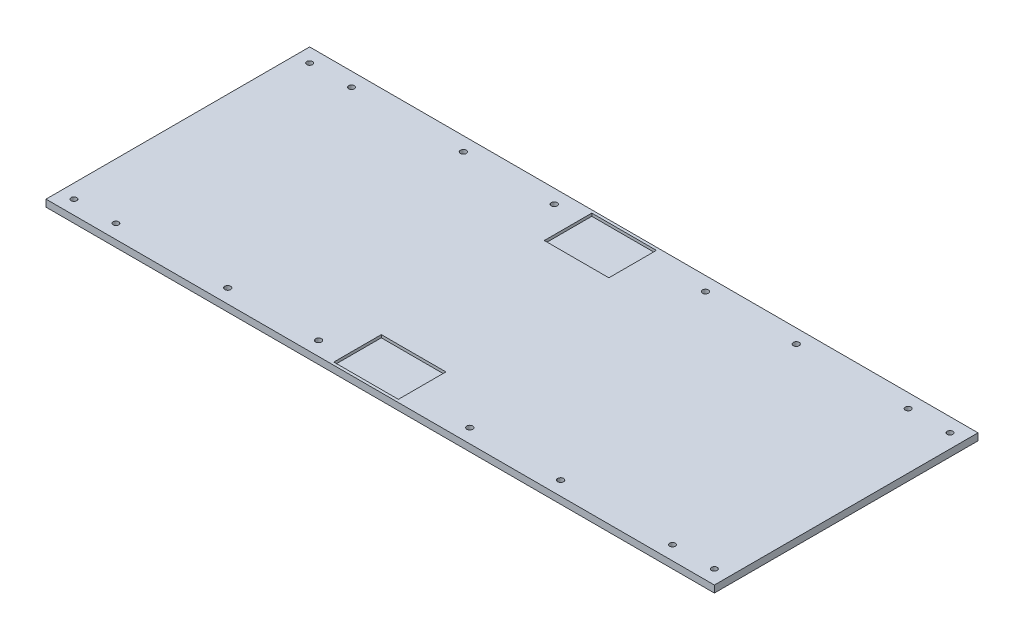
from build123d import *

# Parameters (mm, degrees)
ESQUISSE1_W             = 478.153686012
ESQUISSE1_H             = 188.593708553
ESQUISSE1_R             = 2
BOSS_EXTRU_4_DEPTH      = 5
ESQUISSE2_W             = 35.2
ESQUISSE2_H             = 34
ESQUISSE2_W_2           = 11
ENL_V_MAT_EXTRU_1_DEPTH = 2
ESQUISSE3_R             = 2.1
ENL_V_MAT_EXTRU_2_DEPTH = 10


with BuildPart() as part:
    # Esquisse1 → Boss.-Extru.4 (new body)
    with BuildSketch(Plane(origin=(0, 0, 0), x_dir=(1, 0, 0), z_dir=(0, 1, 0))):
        with Locations((166.159297522, 47.085285911)):
            Rectangle(ESQUISSE1_W, ESQUISSE1_H)
        with Locations(Location((-62.917545484, 131.382140187, 0), (0, 0, 270))):
            Circle(ESQUISSE1_R, mode=Mode.SUBTRACT)
        with Locations(Location((-62.917545484, -37.211568366, 0), (0, 0, 270))):
            Circle(ESQUISSE1_R, mode=Mode.SUBTRACT)
        with Locations(Location((395.236140528, -37.211568366, 0), (0, 0, 270))):
            Circle(ESQUISSE1_R, mode=Mode.SUBTRACT)
        with Locations(Location((395.236140528, 131.382140187, 0), (0, 0, 270))):
            Circle(ESQUISSE1_R, mode=Mode.SUBTRACT)
        with Locations(Location((-32.917545484, -37.211568366, 0), (0, 0, 270))):
            Circle(ESQUISSE1_R, mode=Mode.SUBTRACT)
        with Locations(Location((-32.917545484, 131.382140187, 0), (0, 0, 270))):
            Circle(ESQUISSE1_R, mode=Mode.SUBTRACT)
        with Locations(Location((365.236140528, 131.382140187, 0), (0, 0, 270))):
            Circle(ESQUISSE1_R, mode=Mode.SUBTRACT)
        with Locations(Location((365.236140528, -37.211568366, 0), (0, 0, 270))):
            Circle(ESQUISSE1_R, mode=Mode.SUBTRACT)
    extrude(amount=BOSS_EXTRU_4_DEPTH)

    # Esquisse2 → Enlèv. mat.-Extru.1 (cut)
    with BuildSketch(Plane(origin=(0, 5, 0), x_dir=(1, 0, 0), z_dir=(0, 1, 0))):
        with Locations((148.559297522, 122.382140187)):
            Rectangle(ESQUISSE2_W, ESQUISSE2_H)
        with Locations((171.659297522, 122.382140187)):
            Rectangle(ESQUISSE2_W_2, ESQUISSE2_H)
        with Locations((148.559297522, -28.211568366)):
            Rectangle(ESQUISSE2_W, ESQUISSE2_H)
        with Locations((171.659297522, -28.211568366)):
            Rectangle(ESQUISSE2_W_2, ESQUISSE2_H)
    extrude(amount=-ENL_V_MAT_EXTRU_1_DEPTH, mode=Mode.SUBTRACT)

    # Esquisse3 → Enlèv. mat.-Extru.2 (cut)
    with BuildSketch(Plane(origin=(0, 5, 0), x_dir=(1, 0, 0), z_dir=(0, 1, 0))):
        with Locations(Location((47.082454516, 131.382140187, 0), (0, 0, 270))):
            Circle(ESQUISSE3_R)
        with Locations(Location((47.082454516, -37.211568366, 0), (0, 0, 270))):
            Circle(ESQUISSE3_R)
        with Locations(Location((285.236140528, 131.382140187, 0), (0, 0, 270))):
            Circle(ESQUISSE3_R)
        with Locations(Location((285.236140528, -37.211568366, 0), (0, 0, 270))):
            Circle(ESQUISSE3_R)
        with Locations(Location((220.236140528, 131.382140187, 0), (0, 0, 270))):
            Circle(ESQUISSE3_R)
        with Locations(Location((220.236140528, -37.211568366, 0), (0, 0, 270))):
            Circle(ESQUISSE3_R)
        with Locations(Location((112.082454516, 131.382140187, 0), (0, 0, 270))):
            Circle(ESQUISSE3_R)
        with Locations(Location((112.082454516, -37.211568366, 0), (0, 0, 270))):
            Circle(ESQUISSE3_R)
    extrude(amount=-ENL_V_MAT_EXTRU_2_DEPTH, mode=Mode.SUBTRACT)


solid = part.part
